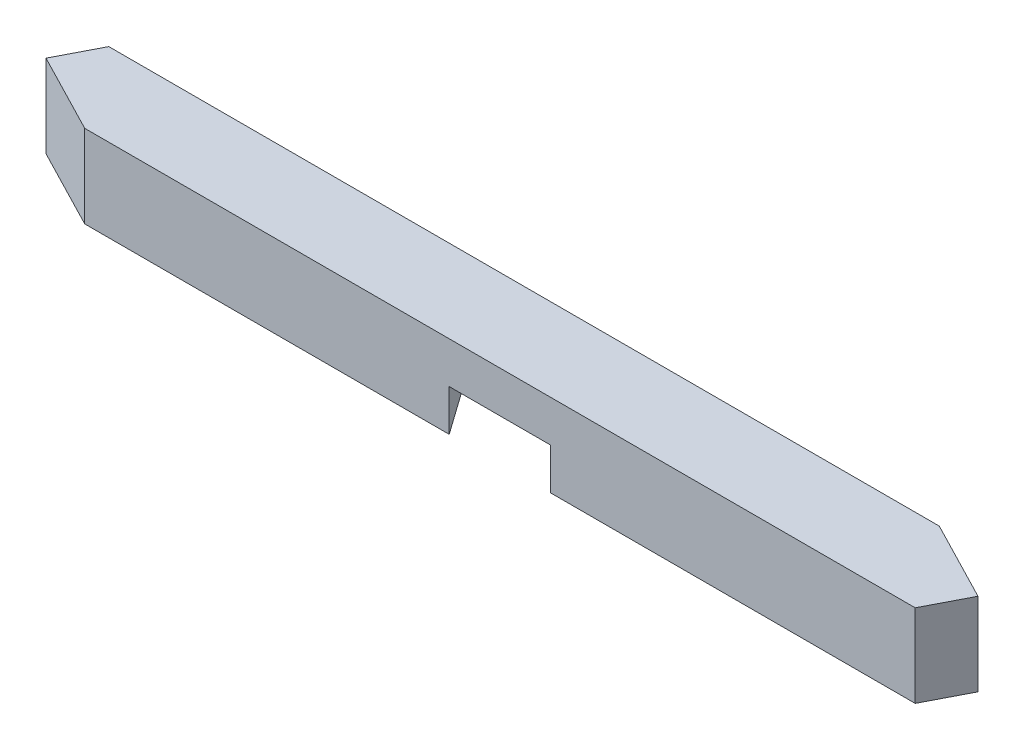
from build123d import *

# Parameters (mm, degrees)
BOSS_EXTRUDE1_DEPTH = 19.05
CUT_EXTRUDE1_DEPTH  = 9.525


with BuildPart() as part:
    # Sketch1 → Boss-Extrude1 (new body)
    with BuildSketch(Plane(origin=(0, 0, 0), x_dir=(1, 0, 0), z_dir=(0, 1, 0))):
        Polygon((0, 0), (4.92125, 9.525), (195.988699991, 9.525), (214.424183862, 0), (209.502933862, -9.525), (18.435483871, -9.525), align=None)
    extrude(amount=BOSS_EXTRUDE1_DEPTH)

    # Sketch3 → Cut-Extrude1 (cut)
    with BuildSketch(Plane(origin=(0, 0, 0), x_dir=(1, 0, 0), z_dir=(0, 1, 0))):
        Polygon((45.179048606, 87.443319882), (40.257798606, 77.918319882), (150.809651385, -77.918319882), (169.245135256, -87.443319882), (174.166385256, -77.918319882), (63.614532477, 77.918319882), align=None)
    extrude(amount=CUT_EXTRUDE1_DEPTH, mode=Mode.SUBTRACT)


solid = part.part
